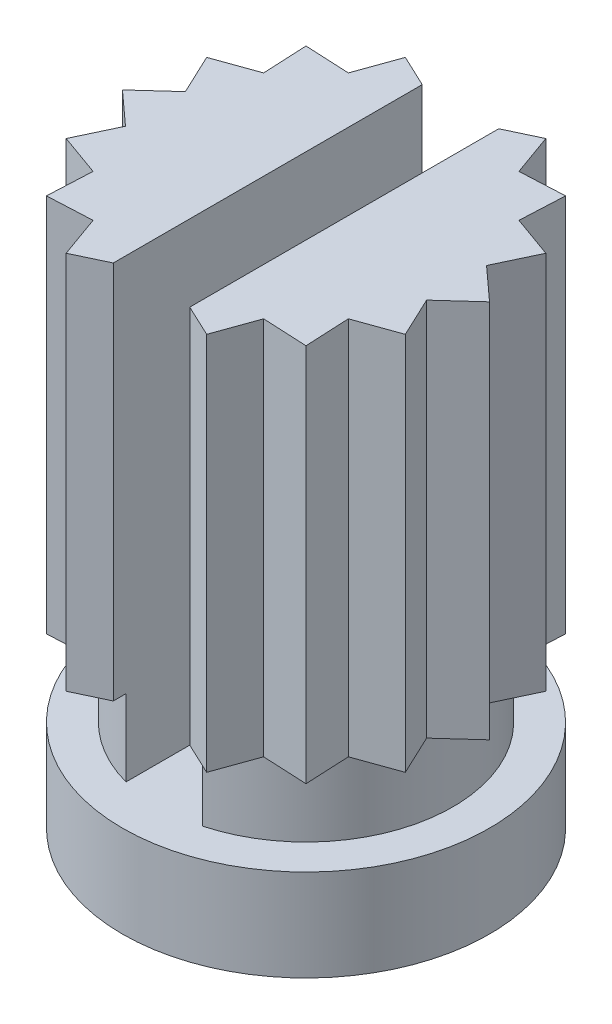
from build123d import *

# Parameters (mm, degrees)
SKETCH1_R           = 3
BOSS_EXTRUDE1_DEPTH = 1.5
SKETCH2_R           = 2.4
BOSS_EXTRUDE2_DEPTH = 1.25
SKETCH4_R           = 3
BOSS_EXTRUDE3_DEPTH = 6.2
CUT_EXTRUDE1_START  = -6.2
CUT_EXTRUDE1_DEPTH  = 6.2
SKETCH6_W           = 1.25
SKETCH6_H           = 6
CUT_EXTRUDE2_DEPTH  = 7.45


with BuildPart() as part:
    # Sketch1 → Boss-Extrude1 (new body)
    with BuildSketch(Plane(origin=(0, 0, 0), x_dir=(1, 0, 0), z_dir=(0, 1, 0))):
        Circle(SKETCH1_R)
    extrude(amount=BOSS_EXTRUDE1_DEPTH)

    # Sketch2 → Boss-Extrude2 (add)
    with BuildSketch(Plane(origin=(0, 1.5, 0), x_dir=(1, 0, 0), z_dir=(0, 1, 0))):
        Circle(SKETCH2_R)
    extrude(amount=BOSS_EXTRUDE2_DEPTH)

    # Sketch4 → Boss-Extrude3 (add)
    with BuildSketch(Plane(origin=(0, 2.75, 0), x_dir=(1, 0, 0), z_dir=(0, 1, 0))):
        Circle(SKETCH4_R)
    extrude(amount=BOSS_EXTRUDE3_DEPTH)

    # Sketch5 → Cut-Extrude1 (cut)
    with BuildSketch(Plane(origin=(0, 8.95, 0), x_dir=(1, 0, 0), z_dir=(0, 1, 0)).offset(CUT_EXTRUDE1_START)):
        with BuildLine():
            ThreePointArc((2.771638598, -1.148050297), (2.942355841, -0.585270966), (3, 0))
            Line((3, 0), (2.461020315, -0.489527377))
            Line((2.461020315, -0.489527377), (2.771638598, -1.148050297))
        make_face()
        with BuildLine():
            Line((2.461020315, 0.489527377), (3, 0))
            ThreePointArc((3, 0), (2.942355841, 0.585270966), (2.771638598, 1.148050297))
            Line((2.771638598, 1.148050297), (2.461020315, 0.489527377))
        make_face()
        with BuildLine():
            Line((2.086352282, 1.394056026), (2.771638598, 1.148050297))
            ThreePointArc((2.771638598, 1.148050297), (2.494408837, 1.666710699), (2.121320344, 2.121320344))
            Line((2.121320344, 2.121320344), (2.086352282, 1.394056026))
        make_face()
        with BuildLine():
            ThreePointArc((2.121320344, -2.121320344), (2.494408837, -1.666710699), (2.771638598, -1.148050297))
            Line((2.771638598, -1.148050297), (2.086352282, -1.394056026))
            Line((2.086352282, -1.394056026), (2.121320344, -2.121320344))
        make_face()
        with BuildLine():
            Line((1.394056026, 2.086352282), (2.121320344, 2.121320344))
            ThreePointArc((2.121320344, 2.121320344), (1.666710699, 2.494408837), (1.148050297, 2.771638598))
            Line((1.148050297, 2.771638598), (1.394056026, 2.086352282))
        make_face()
        with BuildLine():
            ThreePointArc((1.148050297, -2.771638598), (1.666710699, -2.494408837), (2.121320344, -2.121320344))
            Line((2.121320344, -2.121320344), (1.394056026, -2.086352282))
            Line((1.394056026, -2.086352282), (1.148050297, -2.771638598))
        make_face()
        with BuildLine():
            Line((0.489527377, 2.461020315), (1.148050297, 2.771638598))
            ThreePointArc((1.148050297, 2.771638598), (0.585270966, 2.942355841), (0, 3))
            Line((0, 3), (0.489527377, 2.461020315))
        make_face()
        with BuildLine():
            ThreePointArc((0, -3), (0.585270966, -2.942355841), (1.148050297, -2.771638598))
            Line((1.148050297, -2.771638598), (0.489527377, -2.461020315))
            Line((0.489527377, -2.461020315), (0, -3))
        make_face()
        with BuildLine():
            Line((-0.489527377, 2.461020315), (0, 3))
            ThreePointArc((0, 3), (-0.585270966, 2.942355841), (-1.148050297, 2.771638598))
            Line((-1.148050297, 2.771638598), (-0.489527377, 2.461020315))
        make_face()
        with BuildLine():
            ThreePointArc((-1.148050297, -2.771638598), (-0.585270966, -2.942355841), (0, -3))
            Line((0, -3), (-0.489527377, -2.461020315))
            Line((-0.489527377, -2.461020315), (-1.148050297, -2.771638598))
        make_face()
        with BuildLine():
            Line((-1.394056026, 2.086352282), (-1.148050297, 2.771638598))
            ThreePointArc((-1.148050297, 2.771638598), (-1.666710699, 2.494408837), (-2.121320344, 2.121320344))
            Line((-2.121320344, 2.121320344), (-1.394056026, 2.086352282))
        make_face()
        with BuildLine():
            ThreePointArc((-2.121320344, -2.121320344), (-1.666710699, -2.494408837), (-1.148050297, -2.771638598))
            Line((-1.148050297, -2.771638598), (-1.394056026, -2.086352282))
            Line((-1.394056026, -2.086352282), (-2.121320344, -2.121320344))
        make_face()
        with BuildLine():
            Line((-2.086352282, 1.394056026), (-2.121320344, 2.121320344))
            ThreePointArc((-2.121320344, 2.121320344), (-2.494408837, 1.666710699), (-2.771638598, 1.148050297))
            Line((-2.771638598, 1.148050297), (-2.086352282, 1.394056026))
        make_face()
        with BuildLine():
            ThreePointArc((-2.771638598, -1.148050297), (-2.494408837, -1.666710699), (-2.121320344, -2.121320344))
            Line((-2.121320344, -2.121320344), (-2.086352282, -1.394056026))
            Line((-2.086352282, -1.394056026), (-2.771638598, -1.148050297))
        make_face()
        with BuildLine():
            Line((-2.461020315, 0.489527377), (-2.771638598, 1.148050297))
            ThreePointArc((-2.771638598, 1.148050297), (-2.942355841, 0.585270966), (-3, 0))
            Line((-3, 0), (-2.461020315, 0.489527377))
        make_face()
        with BuildLine():
            ThreePointArc((-3, 0), (-2.942355841, -0.585270966), (-2.771638598, -1.148050297))
            Line((-2.771638598, -1.148050297), (-2.461020315, -0.489527377))
            Line((-2.461020315, -0.489527377), (-3, 0))
        make_face()
    extrude(amount=CUT_EXTRUDE1_DEPTH, mode=Mode.SUBTRACT)

    # Sketch6 → Cut-Extrude2 (cut)
    with BuildSketch(Plane(origin=(0, 8.95, 0), x_dir=(1, 0, 0), z_dir=(0, 1, 0))):
        Rectangle(SKETCH6_W, SKETCH6_H)
    extrude(amount=-CUT_EXTRUDE2_DEPTH, mode=Mode.SUBTRACT)


solid = part.part
